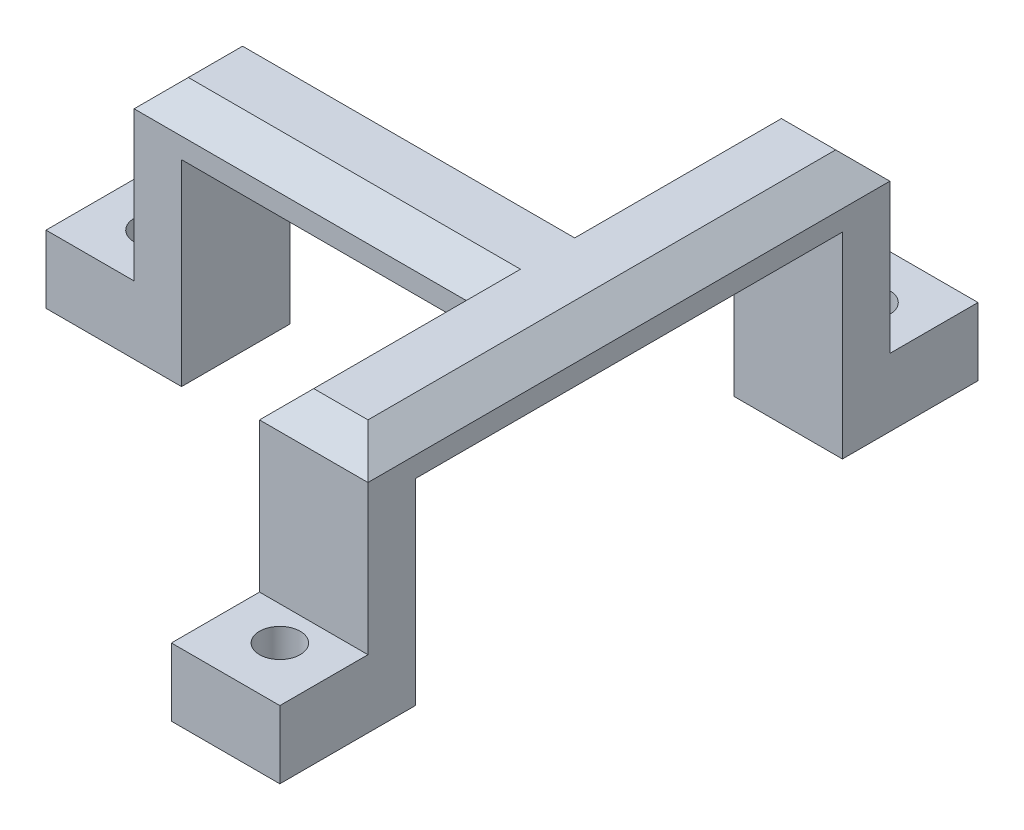
from build123d import *

# Parameters (mm, degrees)
IZIM1_W                       = 10
IZIM1_H                       = 8
IZIM1_R                       = 1.5
Y_KSEKLIK_EKSTR_ZYON1_DEPTH   = 5
IZIM1_W_2                     = 8
IZIM1_H_2                     = 10
Y_KSEKLIK_EKSTR_ZYON1_2_DEPTH = 5
Y_KSEKLIK_EKSTR_ZYON1_3_DEPTH = 5
IZIM2_W                       = 3.5
IZIM2_H                       = 8
IZIM2_W_2                     = 8
IZIM2_H_2                     = 3.5
Y_KSEKLIK_EKSTR_ZYON2_DEPTH   = 13
IZIM3_W                       = 8
IZIM3_H                       = 3.5
Y_KSEKLIK_EKSTR_ZYON3_DEPTH   = 29
IZIM4_W                       = 8
IZIM4_H                       = 3.5
Y_KSEKLIK_EKSTR_ZYON4_DEPTH   = 11.75
IZIM5_W                       = 8
IZIM5_H                       = 3.5
Y_KSEKLIK_EKSTR_ZYON5_DEPTH   = 11.75
PAH1_SIZE                     = 2


with BuildPart() as part:
    # Çizim1 → Yükseklik-Ekstrüzyon1 (new body)
    with BuildSketch(Plane(origin=(0, 0, 0), x_dir=(1, 0, 0), z_dir=(0, 1, 0))):
        with Locations((-30, 0)):
            Rectangle(IZIM1_W, IZIM1_H)
        with Locations(Location((-31, 0, 0), (0, 0, 270))):
            Circle(IZIM1_R, mode=Mode.SUBTRACT)
    extrude(amount=Y_KSEKLIK_EKSTR_ZYON1_DEPTH)



with BuildPart() as body_2:
    # Çizim1 → Y_kseklik-Ekstr_zyon1 2 (new body)
    with BuildSketch(Plane(origin=(0, 0, 0), x_dir=(1, 0, 0), z_dir=(0, 1, 0))):
        with Locations((0, 20.75)):
            Rectangle(IZIM1_W_2, IZIM1_H_2)
        with Locations(Location((0, 21.75, 0), (0, 0, 270))):
            Circle(IZIM1_R, mode=Mode.SUBTRACT)
    extrude(amount=Y_KSEKLIK_EKSTR_ZYON1_2_DEPTH)


with BuildPart() as body_3:
    # Çizim1 → Y_kseklik-Ekstr_zyon1 3 (new body)
    with BuildSketch(Plane(origin=(0, 0, 0), x_dir=(1, 0, 0), z_dir=(0, 1, 0))):
        with Locations((0, -20.75)):
            Rectangle(IZIM1_W_2, IZIM1_H_2)
        with Locations(Location((0, -21.75, 0), (0, 0, 270))):
            Circle(IZIM1_R, mode=Mode.SUBTRACT)
    extrude(amount=Y_KSEKLIK_EKSTR_ZYON1_3_DEPTH)


with BuildPart() as part_1:
    add(part.part)

    add(body_2.part)  # Yükseklik-Ekstrüzyon2 merges body 2

    add(body_3.part)  # Yükseklik-Ekstrüzyon2 merges body 3
    # Çizim2 → Yükseklik-Ekstrüzyon2 (add)
    with BuildSketch(Plane(origin=(0, 5, 0), x_dir=(1, 0, 0), z_dir=(0, 1, 0))):
        with Locations((-26.75, 0)):
            Rectangle(IZIM2_W, IZIM2_H)
        with Locations((0, 17.5)):
            Rectangle(IZIM2_W_2, IZIM2_H_2)
        with Locations((0, -17.5)):
            Rectangle(IZIM2_W_2, IZIM2_H_2)
    extrude(amount=Y_KSEKLIK_EKSTR_ZYON2_DEPTH)

    # Çizim3 → Yükseklik-Ekstrüzyon3 (add)
    with BuildSketch(Plane(origin=(-25, 0, 0), x_dir=(0, 0, -1), z_dir=(1, 0, 0))):
        with Locations((0, 16.25)):
            Rectangle(IZIM3_W, IZIM3_H)
    extrude(amount=Y_KSEKLIK_EKSTR_ZYON3_DEPTH)

    # Çizim4 → Yükseklik-Ekstrüzyon4 (add)
    with BuildSketch(Plane.XY.offset(-15.75)):
        with Locations((0, 16.25)):
            Rectangle(IZIM4_W, IZIM4_H)
    extrude(amount=Y_KSEKLIK_EKSTR_ZYON4_DEPTH)

    # Çizim5 → Yükseklik-Ekstrüzyon5 (add)
    with BuildSketch(Plane(origin=(0, 0, 15.75), x_dir=(-1, 0, 0), z_dir=(0, 0, -1))):
        with Locations((0, 16.25)):
            Rectangle(IZIM5_W, IZIM5_H)
    extrude(amount=Y_KSEKLIK_EKSTR_ZYON5_DEPTH)

    # Pah1
    pah1_edges = [part_1.edges().sort_by_distance(p)[0] for p in [
        (-4, 18, 11.625),
        (0, 18, 19.25),
        (4, 18, 0),
        (-4, 18, -11.625),
        (-16.25, 18, -4),
        (-28.5, 18, 0),
        (-16.25, 18, 4),
        (0, 18, -19.25),
    ]]
    chamfer(pah1_edges, length=PAH1_SIZE)


solid = part_1.part
